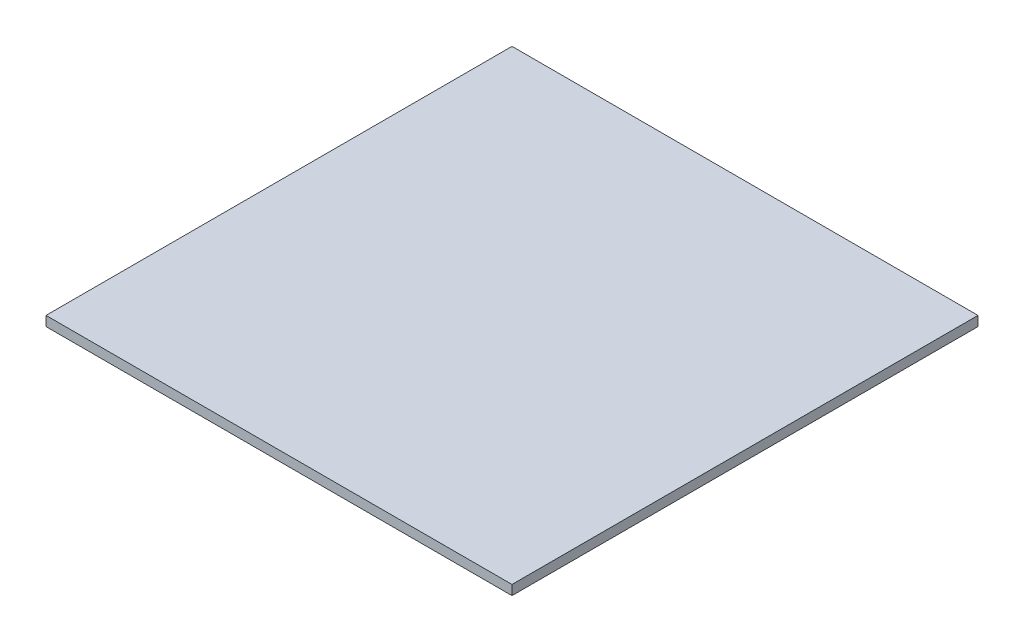
from build123d import *

# Parameters (mm, degrees)
BOSS_EXTRUDE1_DEPTH      = 152.4
BOSS_EXTRUDE1_DEPTH_BACK = 152.4
SKETCH3_W                = 304.8
SKETCH3_H                = 6.35


with BuildPart() as part:
    # Sketch3 → Boss-Extrude1 (new, two sides: drawn at the far end of the back side and taken through both)
    with BuildSketch(Plane.XY.offset(-BOSS_EXTRUDE1_DEPTH_BACK)):
        Rectangle(SKETCH3_W, SKETCH3_H)
    extrude(amount=BOSS_EXTRUDE1_DEPTH + BOSS_EXTRUDE1_DEPTH_BACK)


solid = part.part
